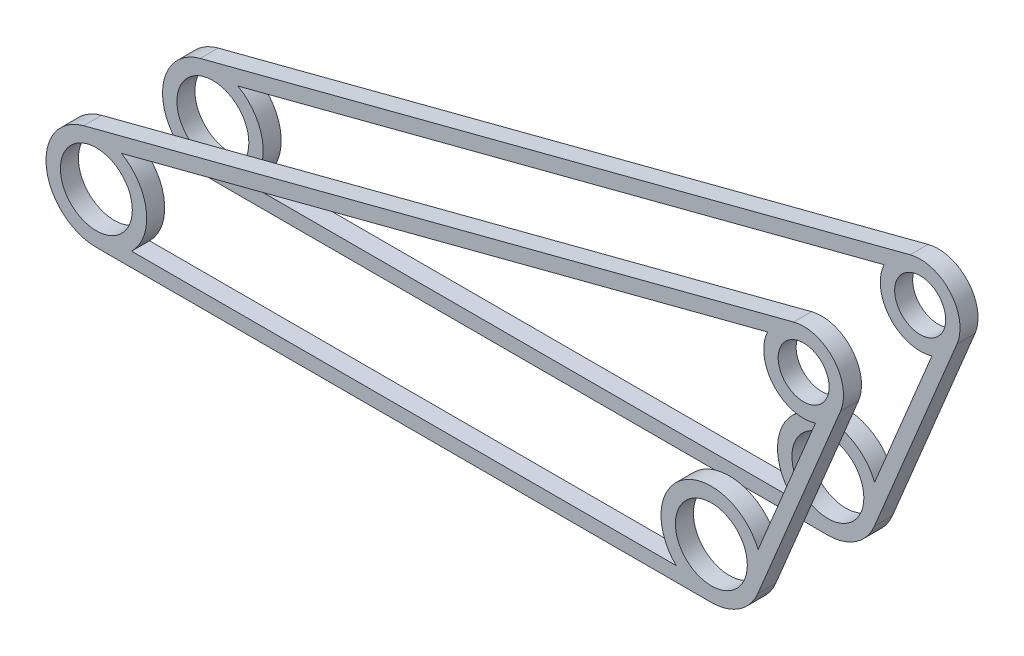
from build123d import *

# Parameters (mm, degrees)
BOSS_EXTRUDE1_START = 8.6995
BOSS_EXTRUDE1_DEPTH = 3.175
BOSS_EXTRUDE2_START = -8.6995
BOSS_EXTRUDE2_DEPTH = 3.175


with BuildPart() as part:
    # Sketch1 → Boss-Extrude1 (new body)
    with BuildSketch(Plane.XY.offset(BOSS_EXTRUDE1_START)):
        with BuildLine():
            Line((123.103161211, 41.253277443), (-2.240939106, 8.602923452))
            ThreePointArc((-2.240939106, 8.602923452), (1.176892963, 8.811754817), (4.420121426, 7.713275995))
            Line((4.420121426, 7.713275995), (118.50424059, 37.43056517))
            ThreePointArc((118.50424059, 37.43056517), (120.377622543, 39.854515613), (123.103161211, 41.253277443))
        make_face()
        with BuildLine():
            ThreePointArc((4.420121426, 7.713275995), (1.176892963, 8.811754817), (-2.240939106, 8.602923452))
            ThreePointArc((-2.240939106, 8.602923452), (-8.817938804, -1.129626157), (0, -8.89))
            ThreePointArc((0, -8.89), (3.360104165, -8.230540687), (6.221703947, -6.35))
            Line((6.221703947, -6.35), (0, -6.35))
            ThreePointArc((0, -6.35), (-6.298527717, -0.806875827), (-1.60067079, 6.144945323))
            Line((-1.60067079, 6.144945323), (4.420121426, 7.713275995))
        make_face()
        with BuildLine():
            ThreePointArc((8.89, 0), (7.691780661, 4.45742193), (4.420121426, 7.713275995))
            Line((4.420121426, 7.713275995), (-1.60067079, 6.144945323))
            ThreePointArc((-1.60067079, 6.144945323), (3.883184292, 5.024279029), (6.35, 0))
            ThreePointArc((6.35, 0), (4.490128061, -4.490128061), (0, -6.35))
            Line((0, -6.35), (6.221703947, -6.35))
            ThreePointArc((6.221703947, -6.35), (8.195823573, -3.443918692), (8.89, 0))
        make_face()
        with BuildLine():
            ThreePointArc((6.221703947, -6.35), (3.360104165, -8.230540687), (0, -8.89))
            Line((0, -8.89), (108.585, -8.89))
            ThreePointArc((108.585, -8.89), (105.224895835, -8.230540687), (102.363296053, -6.35))
            Line((102.363296053, -6.35), (6.221703947, -6.35))
        make_face()
        with BuildLine():
            ThreePointArc((102.363296053, -6.35), (105.224895835, -8.230540687), (108.585, -8.89))
            ThreePointArc((108.585, -8.89), (113.521814689, -7.3932375), (116.796258377, -3.406954044))
            ThreePointArc((116.796258377, -3.406954044), (117.303663515, -1.736953227), (117.475, 0))
            ThreePointArc((117.475, 0), (117.313420536, 1.687238851), (116.834555694, 3.31314516))
            Line((116.834555694, 3.31314516), (114.450184555, -2.433538603))
            ThreePointArc((114.450184555, -2.433538603), (112.111296206, -5.280883928), (108.585, -6.35))
            Line((108.585, -6.35), (102.363296053, -6.35))
        make_face()
        with BuildLine():
            ThreePointArc((116.834555694, 3.31314516), (103.648185311, 7.3932375), (102.363296053, -6.35))
            Line((102.363296053, -6.35), (108.585, -6.35))
            ThreePointArc((108.585, -6.35), (104.094871939, 4.490128061), (114.935, 0))
            ThreePointArc((114.935, 0), (114.812616796, -1.240680876), (114.450184555, -2.433538603))
            Line((114.450184555, -2.433538603), (116.834555694, 3.31314516))
        make_face()
        with BuildLine():
            Line((116.796258377, -3.406954044), (131.38026698, 31.742643294))
            ThreePointArc((131.38026698, 31.742643294), (129.618686837, 29.236265213), (126.959354757, 27.715394219))
            Line((126.959354757, 27.715394219), (116.834555694, 3.31314516))
            ThreePointArc((116.834555694, 3.31314516), (117.313420536, 1.687238851), (117.475, 0))
            ThreePointArc((117.475, 0), (117.303663515, -1.736953227), (116.796258377, -3.406954044))
        make_face()
        with BuildLine():
            ThreePointArc((131.917763158, 34.440613651), (129.182899758, 40.01083796), (123.103161211, 41.253277443))
            ThreePointArc((123.103161211, 41.253277443), (120.377622543, 39.854515613), (118.50424059, 37.43056517))
            Line((118.50424059, 37.43056517), (123.743429527, 38.795299313))
            ThreePointArc((123.743429527, 38.795299313), (127.629626042, 38.001126349), (129.377763158, 34.440613651))
            ThreePointArc((129.377763158, 34.440613651), (129.291034903, 33.561390983), (129.034193158, 32.716058736))
            Line((129.034193158, 32.716058736), (126.959354757, 27.715394219))
            ThreePointArc((126.959354757, 27.715394219), (129.618686837, 29.236265213), (131.38026698, 31.742643294))
            ThreePointArc((131.38026698, 31.742643294), (131.782081622, 33.065118632), (131.917763158, 34.440613651))
        make_face()
        with BuildLine():
            Line((123.743429527, 38.795299313), (118.50424059, 37.43056517))
            ThreePointArc((118.50424059, 37.43056517), (119.567273114, 29.81889368), (126.959354757, 27.715394219))
            Line((126.959354757, 27.715394219), (129.034193158, 32.716058736))
            ThreePointArc((129.034193158, 32.716058736), (121.483273783, 31.486389238), (123.743429527, 38.795299313))
        make_face()
    extrude(amount=BOSS_EXTRUDE1_DEPTH)


with BuildPart() as body_2:
    # Sketch1<4> → Boss-Extrude2 (new body)
    with BuildSketch(Plane.XY.offset(BOSS_EXTRUDE2_START)):
        with BuildLine():
            Line((123.103161211, 41.253277443), (-2.240939106, 8.602923452))
            ThreePointArc((-2.240939106, 8.602923452), (1.176892963, 8.811754817), (4.420121426, 7.713275995))
            Line((4.420121426, 7.713275995), (118.50424059, 37.43056517))
            ThreePointArc((118.50424059, 37.43056517), (120.377622543, 39.854515613), (123.103161211, 41.253277443))
        make_face()
        with BuildLine():
            ThreePointArc((4.420121426, 7.713275995), (1.176892963, 8.811754817), (-2.240939106, 8.602923452))
            ThreePointArc((-2.240939106, 8.602923452), (-8.817938804, -1.129626157), (0, -8.89))
            ThreePointArc((0, -8.89), (3.360104165, -8.230540687), (6.221703947, -6.35))
            Line((6.221703947, -6.35), (0, -6.35))
            ThreePointArc((0, -6.35), (-6.298527717, -0.806875827), (-1.60067079, 6.144945323))
            Line((-1.60067079, 6.144945323), (4.420121426, 7.713275995))
        make_face()
        with BuildLine():
            ThreePointArc((8.89, 0), (7.691780661, 4.45742193), (4.420121426, 7.713275995))
            Line((4.420121426, 7.713275995), (-1.60067079, 6.144945323))
            ThreePointArc((-1.60067079, 6.144945323), (3.883184292, 5.024279029), (6.35, 0))
            ThreePointArc((6.35, 0), (4.490128061, -4.490128061), (0, -6.35))
            Line((0, -6.35), (6.221703947, -6.35))
            ThreePointArc((6.221703947, -6.35), (8.195823573, -3.443918692), (8.89, 0))
        make_face()
        with BuildLine():
            ThreePointArc((6.221703947, -6.35), (3.360104165, -8.230540687), (0, -8.89))
            Line((0, -8.89), (108.585, -8.89))
            ThreePointArc((108.585, -8.89), (105.224895835, -8.230540687), (102.363296053, -6.35))
            Line((102.363296053, -6.35), (6.221703947, -6.35))
        make_face()
        with BuildLine():
            ThreePointArc((102.363296053, -6.35), (105.224895835, -8.230540687), (108.585, -8.89))
            ThreePointArc((108.585, -8.89), (113.521814689, -7.3932375), (116.796258377, -3.406954044))
            ThreePointArc((116.796258377, -3.406954044), (117.303663515, -1.736953227), (117.475, 0))
            ThreePointArc((117.475, 0), (117.313420536, 1.687238851), (116.834555694, 3.31314516))
            Line((116.834555694, 3.31314516), (114.450184555, -2.433538603))
            ThreePointArc((114.450184555, -2.433538603), (112.111296206, -5.280883928), (108.585, -6.35))
            Line((108.585, -6.35), (102.363296053, -6.35))
        make_face()
        with BuildLine():
            ThreePointArc((116.834555694, 3.31314516), (103.648185311, 7.3932375), (102.363296053, -6.35))
            Line((102.363296053, -6.35), (108.585, -6.35))
            ThreePointArc((108.585, -6.35), (104.094871939, 4.490128061), (114.935, 0))
            ThreePointArc((114.935, 0), (114.812616796, -1.240680876), (114.450184555, -2.433538603))
            Line((114.450184555, -2.433538603), (116.834555694, 3.31314516))
        make_face()
        with BuildLine():
            Line((116.796258377, -3.406954044), (131.38026698, 31.742643294))
            ThreePointArc((131.38026698, 31.742643294), (129.618686837, 29.236265213), (126.959354757, 27.715394219))
            Line((126.959354757, 27.715394219), (116.834555694, 3.31314516))
            ThreePointArc((116.834555694, 3.31314516), (117.313420536, 1.687238851), (117.475, 0))
            ThreePointArc((117.475, 0), (117.303663515, -1.736953227), (116.796258377, -3.406954044))
        make_face()
        with BuildLine():
            ThreePointArc((131.917763158, 34.440613651), (129.182899758, 40.01083796), (123.103161211, 41.253277443))
            ThreePointArc((123.103161211, 41.253277443), (120.377622543, 39.854515613), (118.50424059, 37.43056517))
            Line((118.50424059, 37.43056517), (123.743429527, 38.795299313))
            ThreePointArc((123.743429527, 38.795299313), (127.629626042, 38.001126349), (129.377763158, 34.440613651))
            ThreePointArc((129.377763158, 34.440613651), (129.291034903, 33.561390983), (129.034193158, 32.716058736))
            Line((129.034193158, 32.716058736), (126.959354757, 27.715394219))
            ThreePointArc((126.959354757, 27.715394219), (129.618686837, 29.236265213), (131.38026698, 31.742643294))
            ThreePointArc((131.38026698, 31.742643294), (131.782081622, 33.065118632), (131.917763158, 34.440613651))
        make_face()
        with BuildLine():
            Line((123.743429527, 38.795299313), (118.50424059, 37.43056517))
            ThreePointArc((118.50424059, 37.43056517), (119.567273114, 29.81889368), (126.959354757, 27.715394219))
            Line((126.959354757, 27.715394219), (129.034193158, 32.716058736))
            ThreePointArc((129.034193158, 32.716058736), (121.483273783, 31.486389238), (123.743429527, 38.795299313))
        make_face()
    extrude(amount=-BOSS_EXTRUDE2_DEPTH)


solid = Compound([part.part, body_2.part])
